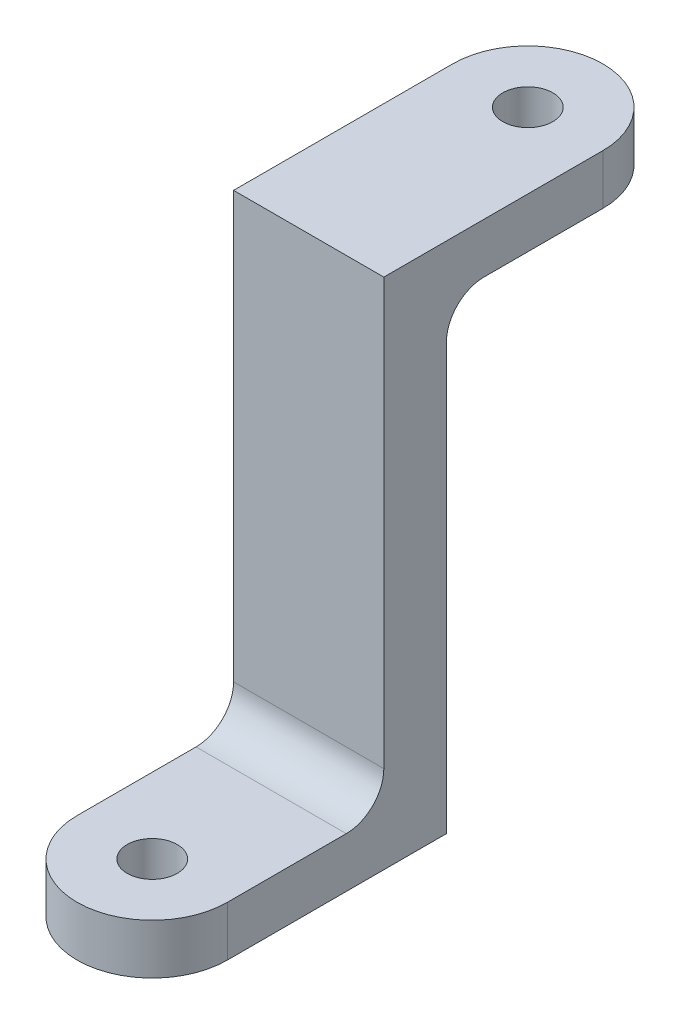
from build123d import *

# Parameters (mm, degrees)
SKETCH1_R                      = 2
BOSS_EXTRUDE1_DEPTH            = 4
SKETCH2_W                      = 12
SKETCH2_H                      = 5
BOSS_EXTRUDE2_DEPTH            = 33
SKETCH3_R                      = 2
SKETCH3_W                      = 12
SKETCH3_H                      = 5
BOSS_EXTRUDE3_DEPTH            = 4
FILLET1_R                      = 3
CUT_EXTRUDE1_REACH             = 53.971
SKETCH4_W                      = 12
SKETCH4_H                      = 19.420745895
CUT_EXTRUDE1_DIRECTION_2_DEPTH = 10


with BuildPart() as part:
    # Sketch1 → Boss-Extrude1 (new body)
    with BuildSketch(Plane(origin=(0, 0, 0), x_dir=(1, 0, 0), z_dir=(0, 1, 0))):
        with BuildLine():
            ThreePointArc((6, 30), (0, 36), (-6, 30))
            Line((-6, 30), (-6, 0))
            ThreePointArc((-6, 0), (0, -6), (6, 0))
            Line((6, 0), (6, 30))
        make_face()
        with Locations(Location((0, 30, 0), (0, 0, 270))):
            Circle(SKETCH1_R, mode=Mode.SUBTRACT)
        with Locations(Location((0, 0, 0), (0, 0, 270))):
            Circle(SKETCH1_R, mode=Mode.SUBTRACT)
    extrude(amount=BOSS_EXTRUDE1_DEPTH)

    # Sketch2 → Boss-Extrude2 (add)
    with BuildSketch(Plane(origin=(0, 4, 0), x_dir=(1, 0, 0), z_dir=(0, 1, 0))):
        with Locations((0, 15)):
            Rectangle(SKETCH2_W, SKETCH2_H)
    extrude(amount=BOSS_EXTRUDE2_DEPTH)

    # Sketch3 → Boss-Extrude3 (add)
    # profile 1 of 2: a face of its own
    with BuildSketch(Plane(origin=(0, 37, 0), x_dir=(1, 0, 0), z_dir=(0, 1, 0))):
        with BuildLine():
            Line((6, 17.5), (6, 30))
            ThreePointArc((6, 30), (0, 36), (-6, 30))
            Line((-6, 30), (-6, 17.5))
            Line((-6, 17.5), (6, 17.5))
        make_face()
        with Locations(Location((0, 30, 0), (0, 0, 270))):
            Circle(SKETCH3_R, mode=Mode.SUBTRACT)
    # profile 2 of 2: a face of its own
    with BuildSketch(Plane(origin=(0, 37, 0), x_dir=(1, 0, 0), z_dir=(0, 1, 0))):
        with Locations((0, 15)):
            Rectangle(SKETCH3_W, SKETCH3_H)
    extrude(amount=BOSS_EXTRUDE3_DEPTH)

    # Fillet1
    fillet1_edges = [part.edges().sort_by_distance(p)[0] for p in [
        (0, 4, -17.5),
        (0, 37, -17.5),
        (0, 4, -12.5),
    ]]
    fillet(fillet1_edges, radius=FILLET1_R)

    # Sketch4 → Cut-Extrude1 (cut, up to next)
    with BuildSketch(Plane(origin=(0, 4, 0), x_dir=(1, 0, 0), z_dir=(0, 1, 0)), mode=Mode.PRIVATE) as cut_extrude1_sk1:
        with Locations((0, 27.210372948)):
            Rectangle(SKETCH4_W, SKETCH4_H)
    cut_extrude1_tool1 = extrude(cut_extrude1_sk1.sketch, amount=-CUT_EXTRUDE1_REACH, mode=Mode.PRIVATE) & part.part
    add(cut_extrude1_tool1.solids().sort_by_distance((0, 4, -27.210373))[0], mode=Mode.SUBTRACT)

    # Sketch4 → Cut-Extrude1 direction 2 (cut)
    with BuildSketch(Plane(origin=(0, 4, 0), x_dir=(1, 0, 0), z_dir=(0, 1, 0))):
        with Locations((0, 27.210372948)):
            Rectangle(SKETCH4_W, SKETCH4_H)
    extrude(amount=CUT_EXTRUDE1_DIRECTION_2_DEPTH, mode=Mode.SUBTRACT)


solid = part.part
